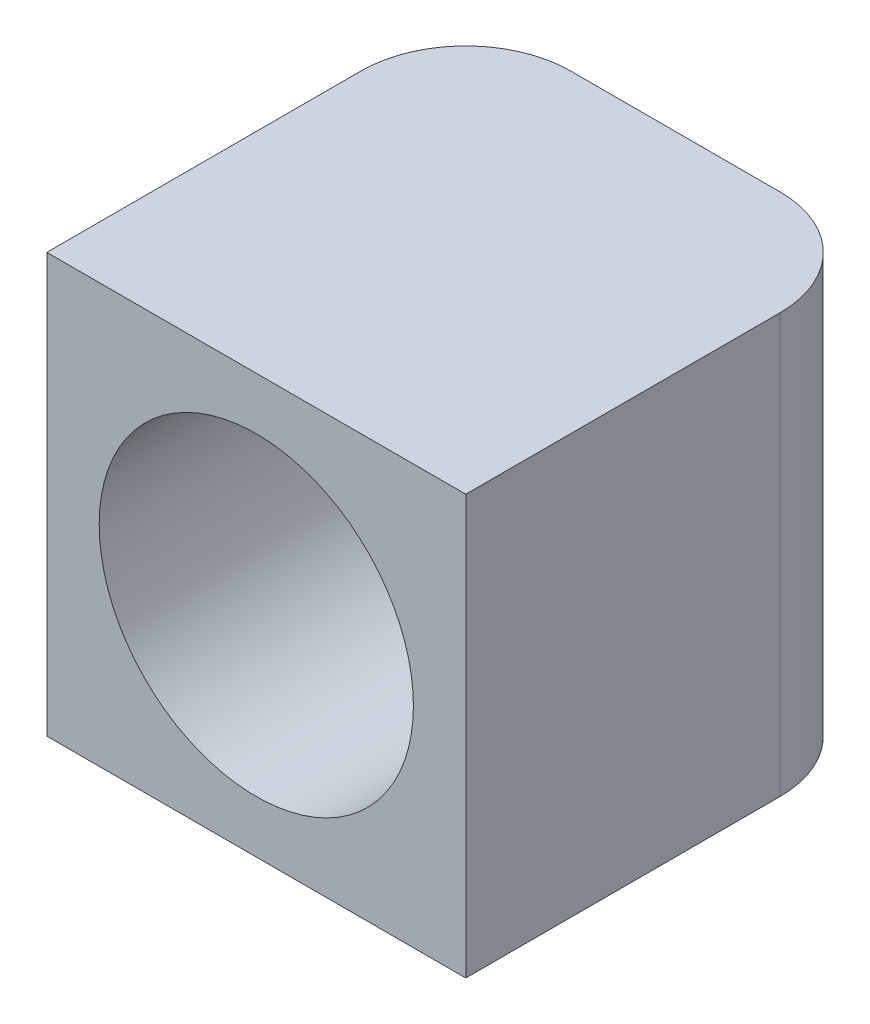
from build123d import *

# Parameters (mm, degrees)
SKETCH2_W           = 4
SKETCH2_H           = 4
BOSS_EXTRUDE1_DEPTH = 4
FILLET1_R           = 1
SKETCH3_R           = 1.5
CUT_EXTRUDE1_DEPTH  = 3


with BuildPart() as part:
    # Sketch2 → Boss-Extrude1 (new body)
    with BuildSketch(Plane(origin=(0, 0, 0), x_dir=(0, 0, -1), z_dir=(1, 0, 0))):
        with Locations((2, 2)):
            Rectangle(SKETCH2_W, SKETCH2_H)
    extrude(amount=BOSS_EXTRUDE1_DEPTH)

    # Fillet1
    fillet1_edges = [part.edges().sort_by_distance(p)[0] for p in [
        (4, 2, -4),
        (0, 2, -4),
    ]]
    fillet(fillet1_edges, radius=FILLET1_R)

    # Sketch3 → Cut-Extrude1 (cut)
    with BuildSketch(Plane.XY):
        with Locations((2, 2)):
            Circle(SKETCH3_R)
    extrude(amount=-CUT_EXTRUDE1_DEPTH, mode=Mode.SUBTRACT)


solid = part.part
